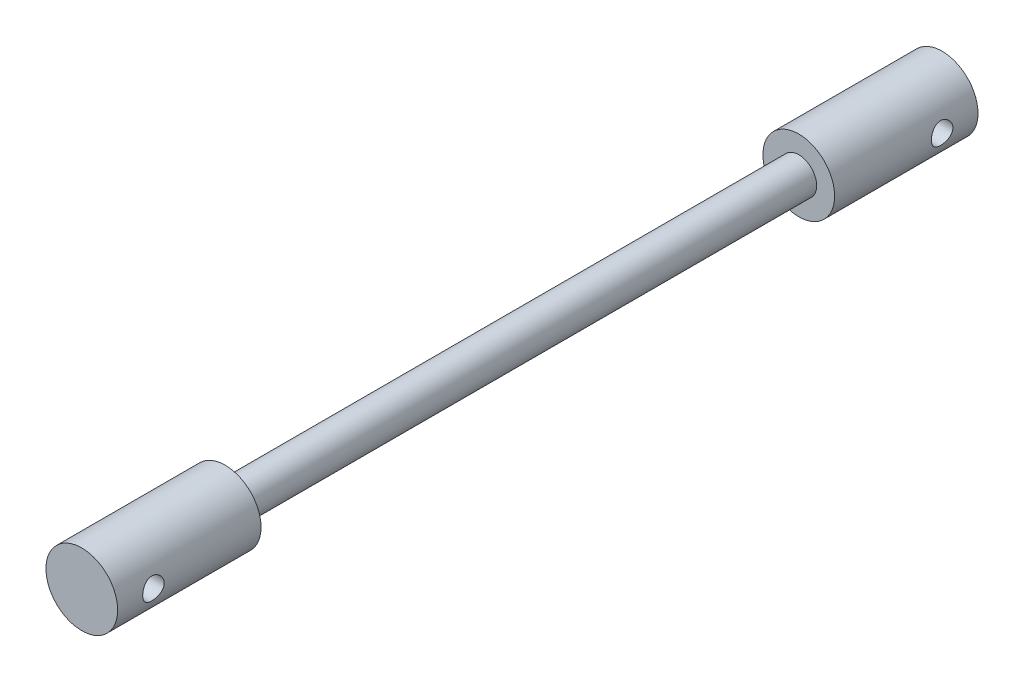
from build123d import *

# Parameters (mm, degrees)
SKETCH1_R           = 5
BOSS_EXTRUDE1_DEPTH = 20
SKETCH3_R           = 2.5
BOSS_EXTRUDE2_DEPTH = 40
SKETCH7_R           = 1.5
CUT_EXTRUDE1_DEPTH  = 62.032778079
SKETCH9_R           = 1.5
CUT_EXTRUDE2_DEPTH  = 121.519707944


with BuildPart() as part:
    # Sketch1 → Boss-Extrude1 (new body)
    with BuildSketch(Plane.XY):
        Circle(SKETCH1_R)
    boss_extrude1 = extrude(amount=BOSS_EXTRUDE1_DEPTH)

    # Sketch3 → Boss-Extrude2 (add)
    with BuildSketch(Plane.XY.offset(20)):
        Circle(SKETCH3_R)
    boss_extrude2 = extrude(amount=BOSS_EXTRUDE2_DEPTH)

    # Sketch7 → Cut-Extrude1 (cut, through all)
    with BuildSketch(Plane(origin=(5, 0, 0), x_dir=(0, 0, -1), z_dir=(1, 0, 0))):
        with Locations((-5, 0)):
            Circle(SKETCH7_R)
    extrude(amount=-CUT_EXTRUDE1_DEPTH, mode=Mode.SUBTRACT)

    # Mirror4: Boss-Extrude2 across plane
    add(boss_extrude2.mirror(Plane.XY.offset(60)))

    # Mirror5: Boss-Extrude1 across plane
    add(boss_extrude1.mirror(Plane.XY.offset(60)))

    # Sketch9 → Cut-Extrude2 (cut, through all)
    with BuildSketch(Plane(origin=(5, 0, 0), x_dir=(0, 0, -1), z_dir=(1, 0, 0))):
        with Locations((-115, 0)):
            Circle(SKETCH9_R)
    extrude(amount=-CUT_EXTRUDE2_DEPTH, mode=Mode.SUBTRACT)


solid = part.part
